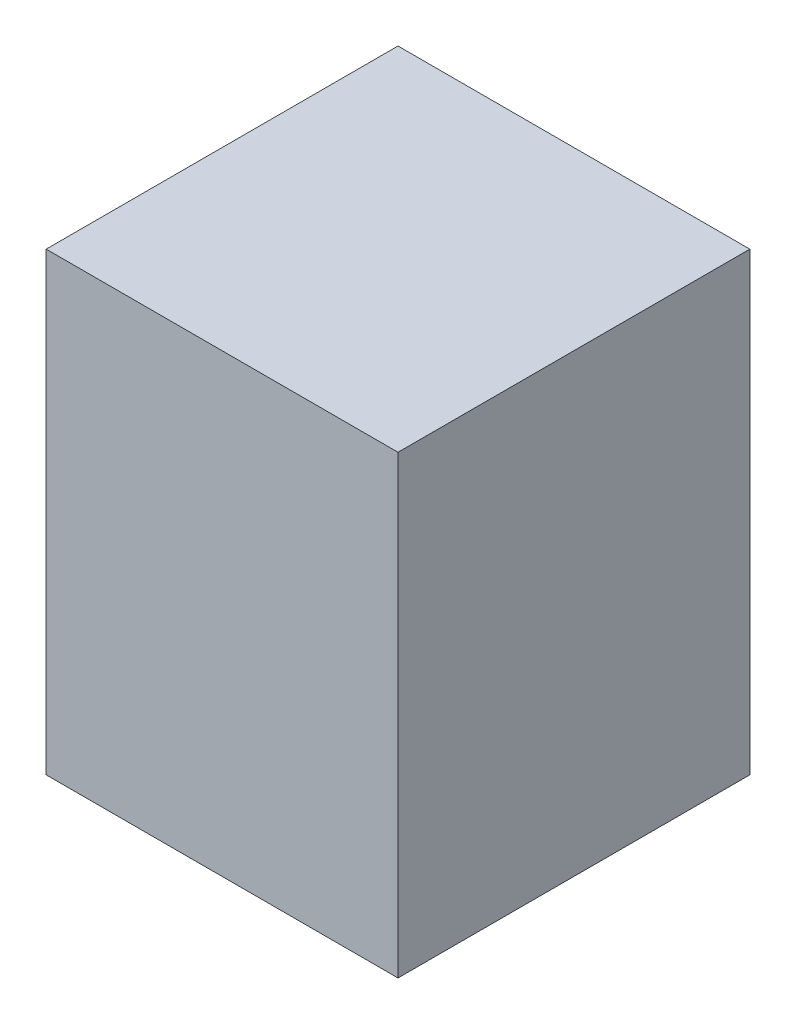
from build123d import *

# Parameters (mm, degrees)
SKETCH1_W           = 5181.6
SKETCH1_H           = 5181.6
BOSS_EXTRUDE1_DEPTH = 6705.6
SHELL1_T            = -304.8


with BuildPart() as part:
    # Sketch1 → Boss-Extrude1 (new body)
    with BuildSketch(Plane(origin=(0, 0, 0), x_dir=(1, 0, 0), z_dir=(0, 1, 0))):
        Rectangle(SKETCH1_W, SKETCH1_H)
    extrude(amount=BOSS_EXTRUDE1_DEPTH)

    # Shell1
    shell1_openings = [part.faces().sort_by_distance(p)[0] for p in [
        (0, 0, 0),
    ]]
    offset(amount=SHELL1_T, openings=shell1_openings, kind=Kind.INTERSECTION)


solid = part.part
